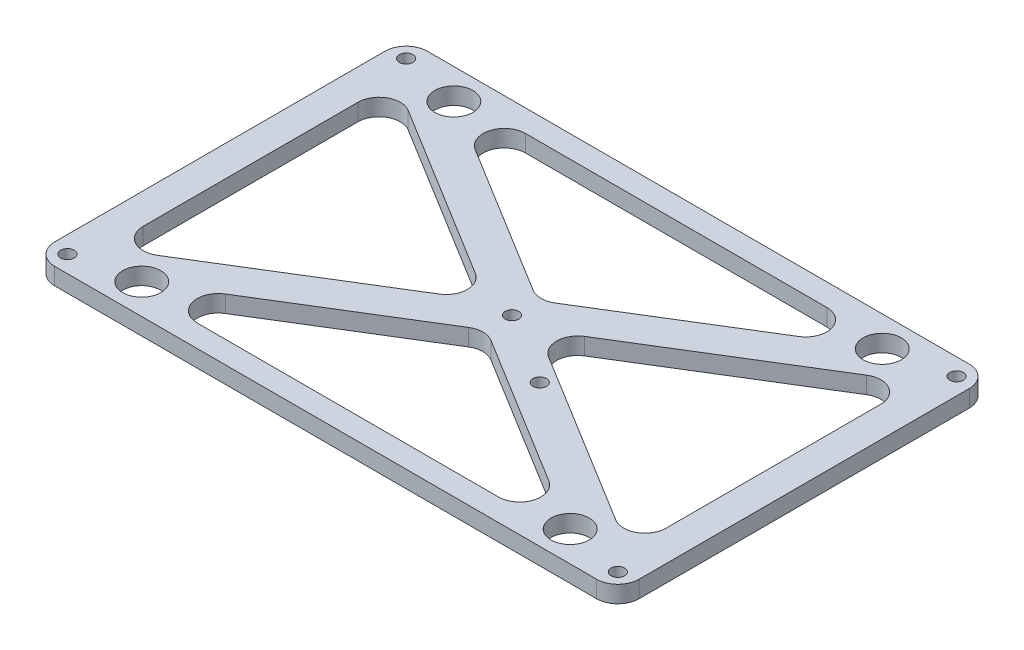
from build123d import *

# Parameters (mm, degrees)
SKETCH_1_W          = 138
SKETCH_1_H          = 88
SKETCH_1_R          = 1.6
EXTRUDE_1_DEPTH     = 4
FILLET_1_R          = 5
FILLET_2_R          = 5
SKETCH_2_R          = 4.5
CUT_EXTRUDE_1_DEPTH = 82.932899375
SKETCH_3_R          = 1.6
CUT_EXTRUDE_2_DEPTH = 82.932899375


with BuildPart() as part:
    # 草图1 → 凸台-拉伸1 (new body)
    with BuildSketch(Plane(origin=(0, 0, 0), x_dir=(1, 0, 0), z_dir=(0, 1, 0))):
        Rectangle(SKETCH_1_W, SKETCH_1_H)
        with Locations(Location((65, 40, 0), (0, 0, 270))):
            Circle(SKETCH_1_R, mode=Mode.SUBTRACT)
        with Locations(Location((65, -40, 0), (0, 0, 270))):
            Circle(SKETCH_1_R, mode=Mode.SUBTRACT)
        with Locations(Location((-65, -40, 0), (0, 0, 270))):
            Circle(SKETCH_1_R, mode=Mode.SUBTRACT)
        with Locations(Location((-65, 40, 0), (0, 0, 270))):
            Circle(SKETCH_1_R, mode=Mode.SUBTRACT)
        Polygon((-53.25, 38.769230769), (0, 6), (53.25, 38.769230769), align=None, mode=Mode.SUBTRACT)
        Polygon((53.25, -38.769230769), (0, -6), (-53.25, -38.769230769), align=None, mode=Mode.SUBTRACT)
        Polygon((-61.75, -34.307692308), (-6, 0), (-61.75, 34.307692308), align=None, mode=Mode.SUBTRACT)
        Polygon((61.75, -34.307692308), (6, 0), (61.75, 34.307692308), align=None, mode=Mode.SUBTRACT)
    extrude(amount=EXTRUDE_1_DEPTH)

    # 圆角1
    fillet_1_edges = [part.edges().sort_by_distance(p)[0] for p in [
        (0, 2, -6),
        (53.25, 2, -38.769230769),
        (-53.25, 2, -38.769230769),
        (0, 2, 6),
        (-53.25, 2, 38.769230769),
        (53.25, 2, 38.769230769),
        (-6, 2, 0),
        (-61.75, 2, -34.307692308),
        (-61.75, 2, 34.307692308),
        (61.75, 2, -34.307692308),
        (6, 2, 0),
        (61.75, 2, 34.307692308),
    ]]
    fillet(fillet_1_edges, radius=FILLET_1_R)

    # 圆角2
    fillet_2_edges = [part.edges().sort_by_distance(p)[0] for p in [
        (69, 2, 44),
        (-69, 2, 44),
        (-69, 2, -44),
        (69, 2, -44),
    ]]
    fillet(fillet_2_edges, radius=FILLET_2_R)

    # 草图2 → 切除-拉伸1 (cut, through all)
    with BuildSketch(Plane(origin=(0, 4, 0), x_dir=(1, 0, 0), z_dir=(0, 1, 0))):
        with Locations(Location((50.58680401, -36.855868382, 0), (0, 0, 270))):
            Circle(SKETCH_2_R)
        with Locations(Location((-50.58680401, -36.855868382, 0), (0, 0, 90))):
            Circle(SKETCH_2_R)
        with Locations(Location((-50.58680401, 36.855868382, 0), (0, 0, 270))):
            Circle(SKETCH_2_R)
        with Locations(Location((50.58680401, 36.855868382, 0), (0, 0, 90))):
            Circle(SKETCH_2_R)
    extrude(amount=-CUT_EXTRUDE_1_DEPTH, mode=Mode.SUBTRACT)

    # 草图3 → 切除-拉伸2 (cut, through all)
    with BuildSketch(Plane(origin=(0, 4, 0), x_dir=(1, 0, 0), z_dir=(0, 1, 0))):
        with Locations(Location((17.033166334, -10.481948513, 0), (0, 0, 270))):
            Circle(SKETCH_3_R)
        with Locations(Location((0, 0, 0), (0, 0, 270))):
            Circle(SKETCH_3_R)
    extrude(amount=-CUT_EXTRUDE_2_DEPTH, mode=Mode.SUBTRACT)


solid = part.part
